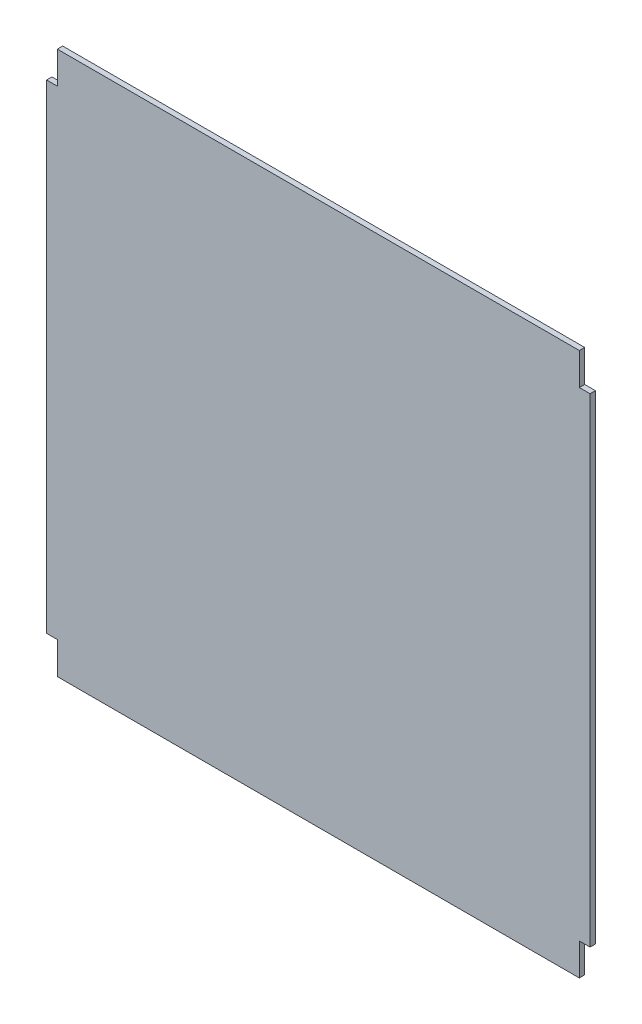
from build123d import *

# Parameters (mm, degrees)
SKETCH1_W           = 508
SKETCH1_H           = 508
BOSS_EXTRUDE1_DEPTH = 4
SKETCH3_W           = 406.4
SKETCH3_H           = 406.4
CUT_EXTRUDE1_DEPTH  = 4
SKETCH4_W           = 508
SKETCH4_H           = 508
BOSS_EXTRUDE2_DEPTH = 1
SKETCH5_W           = 10
SKETCH5_H           = 30
CUT_EXTRUDE2_DEPTH  = 5


with BuildPart() as part:
    # Sketch1 → Boss-Extrude1 (new body)
    with BuildSketch(Plane.XY):
        with Locations((-254, 254)):
            Rectangle(SKETCH1_W, SKETCH1_H)
    extrude(amount=BOSS_EXTRUDE1_DEPTH)

    # Sketch3 → Cut-Extrude1 (cut)
    with BuildSketch(Plane.XY.offset(4)):
        with Locations((-254, 254)):
            Rectangle(SKETCH3_W, SKETCH3_H)
    extrude(amount=-CUT_EXTRUDE1_DEPTH, mode=Mode.SUBTRACT)

    # Sketch4 → Boss-Extrude2 (add)
    with BuildSketch(Plane.XY.offset(4)):
        with Locations((-254, 254)):
            Rectangle(SKETCH4_W, SKETCH4_H)
    extrude(amount=BOSS_EXTRUDE2_DEPTH)

    # Sketch5 → Cut-Extrude2 (cut)
    with BuildSketch(Plane(origin=(0, 0, 0), x_dir=(-1, 0, 0), z_dir=(0, 0, -1))):
        with Locations((5, 493)):
            Rectangle(SKETCH5_W, SKETCH5_H)
        with Locations((503, 493)):
            Rectangle(SKETCH5_W, SKETCH5_H)
        with Locations((503, 15)):
            Rectangle(SKETCH5_W, SKETCH5_H)
        with Locations((5, 15)):
            Rectangle(SKETCH5_W, SKETCH5_H)
    extrude(amount=-CUT_EXTRUDE2_DEPTH, mode=Mode.SUBTRACT)


solid = part.part
